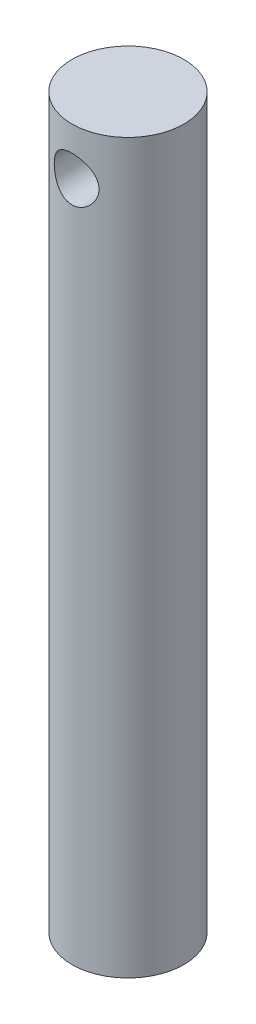
from build123d import *

# Parameters (mm, degrees)
SKETCH_1_R          = 10
EXTRUDE_1_DEPTH     = 130
SKETCH_2_R          = 4
CUT_EXTRUDE_2_DEPTH = 25


with BuildPart() as part:
    # Эскиз1 → Вытянуть1 (new body)
    with BuildSketch(Plane(origin=(0, 0, 0), x_dir=(1, 0, 0), z_dir=(0, 1, 0))):
        with Locations(Location((0, 0, 0), (0, 0, 270))):
            Circle(SKETCH_1_R)
    extrude(amount=EXTRUDE_1_DEPTH)

    # Эскиз2 → Вытянуть2 (cut, symmetric)
    with BuildSketch(Plane.XY):
        with Locations(Location((0, 121.5, 0), (0, 0, 89.999999999))):
            Circle(SKETCH_2_R)
    extrude(amount=CUT_EXTRUDE_2_DEPTH, both=True, mode=Mode.SUBTRACT)


solid = part.part
